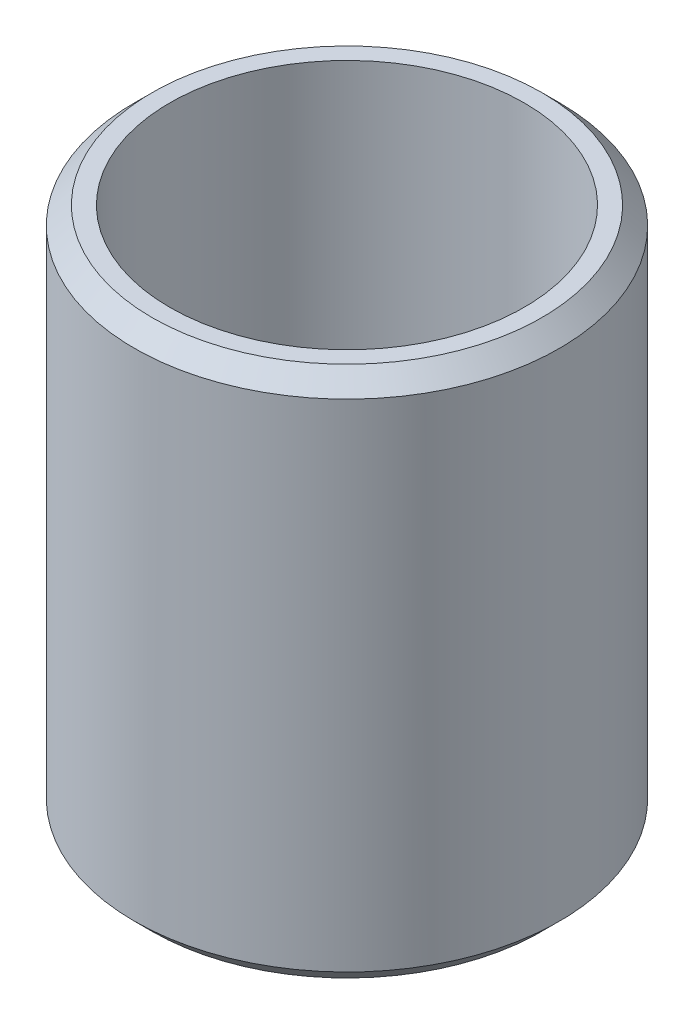
from build123d import *

# Parameters (mm, degrees)
SKETCH1_R           = 1.524
SKETCH1_R_2         = 1.27
BOSS_EXTRUDE1_DEPTH = 3.81
CHAMFER1_SIZE       = 0.127


with BuildPart() as part:
    # Sketch1 → Boss-Extrude1 (new body)
    with BuildSketch(Plane(origin=(0, 0, 0), x_dir=(1, 0, 0), z_dir=(0, 1, 0))):
        with Locations(Location((0, 0, 0), (0, 0, 90))):
            Circle(SKETCH1_R)
        with Locations(Location((0, 0, 0), (0, 0, 90))):
            Circle(SKETCH1_R_2, mode=Mode.SUBTRACT)
    extrude(amount=BOSS_EXTRUDE1_DEPTH)

    # Chamfer1
    chamfer1_edges = [part.edges().sort_by_distance(p)[0] for p in [
        (0, 0, 1.524),
        (0, 3.81, 1.524),
    ]]
    chamfer(chamfer1_edges, length=CHAMFER1_SIZE)


solid = part.part
